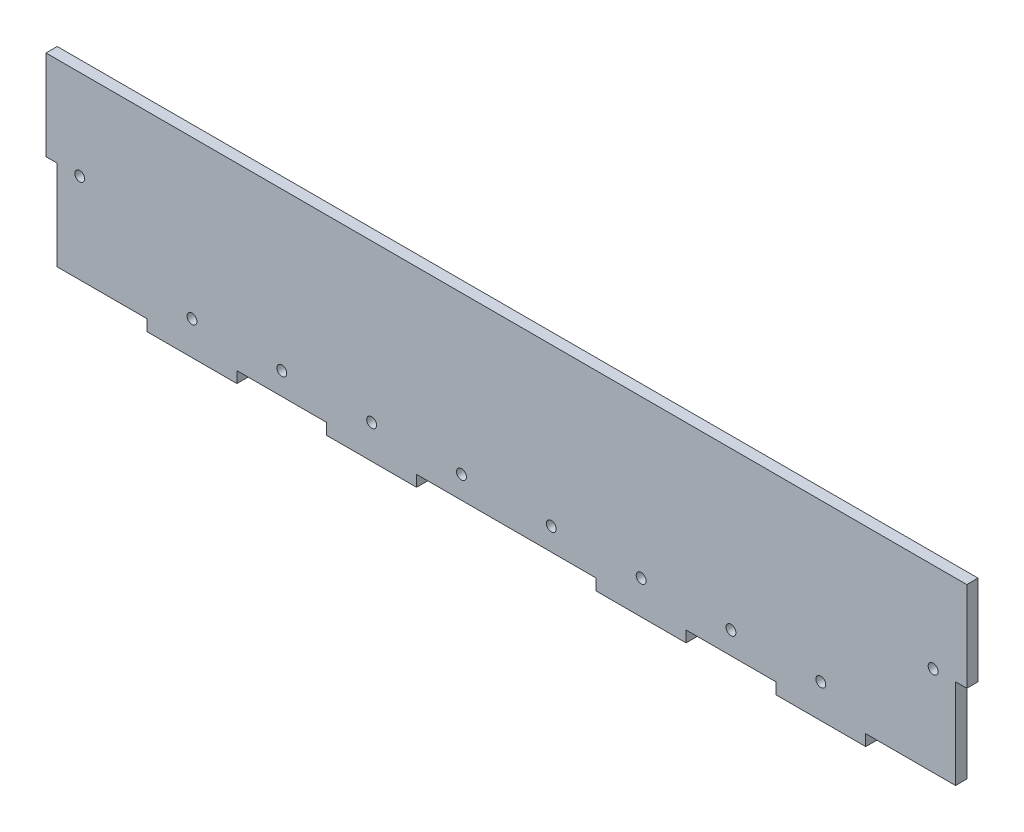
from build123d import *

# Parameters (mm, degrees)
SKETCH_1_R          = 2.2
EXTRUDE_1_DEPTH     = 5
SKETCH_2_W          = 410
SKETCH_2_H          = 226.105378696
CUT_EXTRUDE_2_DEPTH = 5
SKETCH_4_W          = 410
SKETCH_4_H          = 19.486670542
EXTRUDE_3_DEPTH     = 5


with BuildPart() as part:
    # 草图1 → 凸台-拉伸1 (new body)
    with BuildSketch(Plane.XY):
        Polygon((-200, 150), (200, 150), (200, 110), (205, 110), (205, 70), (200, 70), (200, 30), (205, 30), (205, -30), (200, -30), (200, -70), (205, -70), (205, -110), (200, -110), (200, -150), (160, -150), (160, -155), (120, -155), (120, -150), (80, -150), (80, -155), (40, -155), (40, -150), (-40, -150), (-40, -155), (-80, -155), (-80, -150), (-120, -150), (-120, -155), (-160, -155), (-160, -150), (-200, -150), (-200, -110), (-205, -110), (-205, -70), (-200, -70), (-200, -30), (-205, -30), (-205, 30), (-200, 30), (-200, 70), (-205, 70), (-205, 110), (-200, 110), align=None)
        with Locations((-140, -140)):
            Circle(SKETCH_1_R, mode=Mode.SUBTRACT)
        with Locations((-100, -140)):
            Circle(SKETCH_1_R, mode=Mode.SUBTRACT)
        with Locations((-60, -140)):
            Circle(SKETCH_1_R, mode=Mode.SUBTRACT)
        with Locations((-20, -140)):
            Circle(SKETCH_1_R, mode=Mode.SUBTRACT)
        with Locations((20, -140)):
            Circle(SKETCH_1_R, mode=Mode.SUBTRACT)
        with Locations((60, -140)):
            Circle(SKETCH_1_R, mode=Mode.SUBTRACT)
        with Locations((100, -140)):
            Circle(SKETCH_1_R, mode=Mode.SUBTRACT)
        with Locations((140, -140)):
            Circle(SKETCH_1_R, mode=Mode.SUBTRACT)
        with Locations((-190, 110)):
            Circle(SKETCH_1_R, mode=Mode.SUBTRACT)
        with Locations((-190, 70)):
            Circle(SKETCH_1_R, mode=Mode.SUBTRACT)
        with Locations((-190, 30)):
            Circle(SKETCH_1_R, mode=Mode.SUBTRACT)
        with Locations((-190, -30)):
            Circle(SKETCH_1_R, mode=Mode.SUBTRACT)
        with Locations((-190, -70)):
            Circle(SKETCH_1_R, mode=Mode.SUBTRACT)
        with Locations((-190, -110)):
            Circle(SKETCH_1_R, mode=Mode.SUBTRACT)
        with Locations((190, -110)):
            Circle(SKETCH_1_R, mode=Mode.SUBTRACT)
        with Locations((190, -70)):
            Circle(SKETCH_1_R, mode=Mode.SUBTRACT)
        with Locations((190, -30)):
            Circle(SKETCH_1_R, mode=Mode.SUBTRACT)
        with Locations((190, 30)):
            Circle(SKETCH_1_R, mode=Mode.SUBTRACT)
        with Locations((190, 70)):
            Circle(SKETCH_1_R, mode=Mode.SUBTRACT)
        with Locations((190, 110)):
            Circle(SKETCH_1_R, mode=Mode.SUBTRACT)
    extrude(amount=EXTRUDE_1_DEPTH)

    # 草图2 → 切除-拉伸2 (cut)
    with BuildSketch(Plane.XY.offset(5)):
        with Locations((0, 43.052689348)):
            Rectangle(SKETCH_2_W, SKETCH_2_H)
    extrude(amount=-CUT_EXTRUDE_2_DEPTH, mode=Mode.SUBTRACT)

    # 草图4 → 凸台-拉伸3 (add)
    with BuildSketch(Plane.XY.offset(5)):
        with Locations((0, -79.743335271)):
            Rectangle(SKETCH_4_W, SKETCH_4_H)
    extrude(amount=-EXTRUDE_3_DEPTH)


solid = part.part
